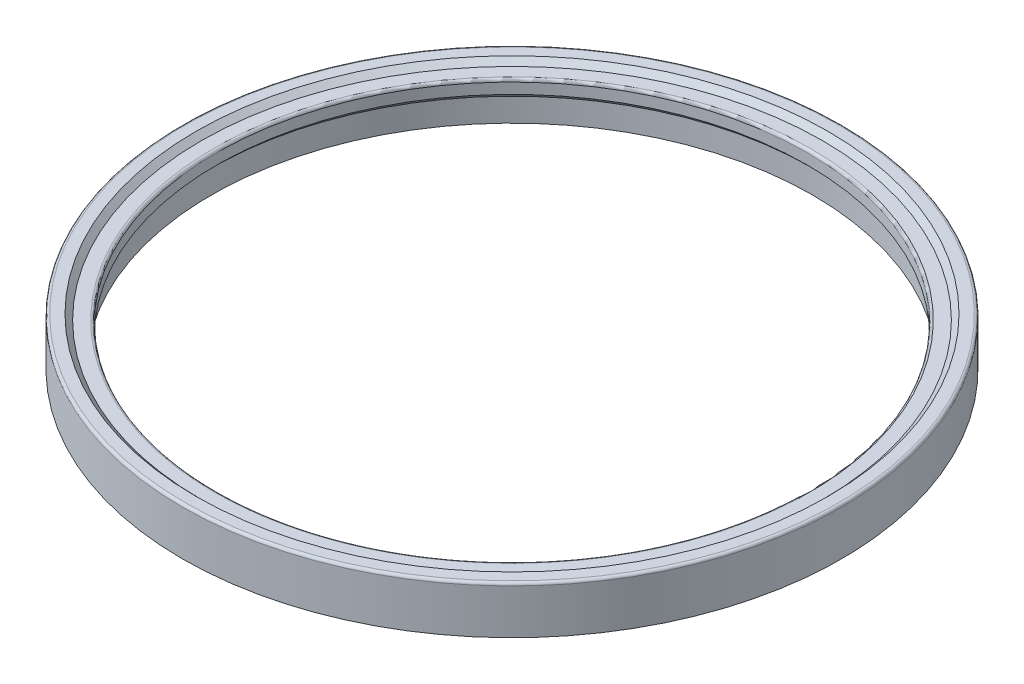
from build123d import *

# Parameters (mm, degrees)
SKETCH4_R          = 1.85
CUT_EXTRUDE1_DEPTH = 6
CIRPATTERN1_COUNT  = 10


with BuildPart() as part:
    # Sketch3 (on Front Plane) → Revolve2 (revolve)
    with BuildSketch(Plane.XY, mode=Mode.PRIVATE) as revolve2_sk:
        with BuildLine():
            Line((-117.849137803, -13.05), (-113, -13.05))
            ThreePointArc((-113, -13.05), (-112.292893219, -13.342893219), (-112, -14.05))
            Line((-112, -14.05), (-112, -18.100862197))
            Line((-112, -18.100862197), (-114.05, -20.150862197))
            Line((-114.05, -20.150862197), (-114.05, -29))
            Line((-114.05, -29), (-125, -29))
            Line((-125, -29), (-125, -12))
            ThreePointArc((-125, -12), (-124.707106781, -11.292893219), (-124, -11))
            Line((-124, -11), (-119.899137803, -11))
            Line((-119.899137803, -11), (-117.849137803, -13.05))
        make_face()
    revolve(revolve2_sk.sketch.rotate(Axis((0, 0, 0), (0, 1, 0)), 270), axis=Axis((0, 0, 0), (0, 1, 0)))

    # Sketch4 → Cut-Extrude1 (cut)
    with BuildSketch(Plane.XZ.offset(29)):
        with Locations(Location((0, -119.525, 0), (0, 0, 270))):
            Circle(SKETCH4_R)
    cut_extrude1 = extrude(amount=-CUT_EXTRUDE1_DEPTH, mode=Mode.SUBTRACT)

    # CirPattern1: Cut-Extrude1 ×10 about axis
    cirpattern1_axis = Axis((0, 0, 0), (0, 1, 0))
    for i in range(1, CIRPATTERN1_COUNT):
        add(cut_extrude1.rotate(cirpattern1_axis, i * 360 / CIRPATTERN1_COUNT), mode=Mode.SUBTRACT)


solid = part.part
